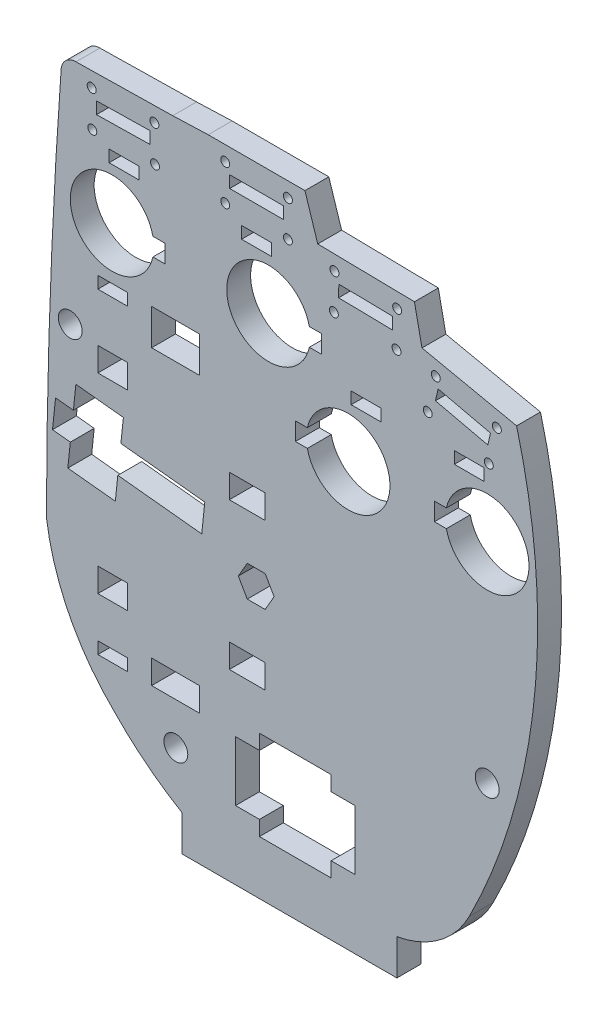
from build123d import *

# Parameters (mm, degrees)
SKETCH1_R           = 2
SKETCH1_R_2         = 0.75
SKETCH1_W           = 9
SKETCH1_H           = 2
SKETCH1_W_2         = 5
SKETCH1_W_3         = 8
SKETCH1_H_2         = 6
SKETCH1_H_3         = 4
SKETCH1_W_4         = 6
BOSS_EXTRUDE1_DEPTH = 4


with BuildPart() as part:
    # Sketch1 → Boss-Extrude1 (new body)
    with BuildSketch(Plane.XY):
        with BuildLine():
            Line((-0.718612481, -17.999985362), (-0.718612481, -23.999985362))
            Line((-0.718612481, -23.999985362), (35.281387519, -23.999985362))
            Line((35.281387519, -23.999985362), (35.281387519, -17.999985362))
            ThreePointArc((35.281387519, -17.999985362), (42.406223237, -14.93064645), (47.407370228, -8.999992681))
            ThreePointArc((47.407370228, -8.999992681), (58.276211887, 27.829327454), (55.330365794, 66.115781082))
            Line((55.330365794, 66.115781082), (39.484374663, 69.483950474))
            Line((39.484374663, 69.483950474), (38.221859922, 75.558279649))
            Line((38.221859922, 75.558279649), (22.02432726, 75.841009004))
            Line((22.02432726, 75.841009004), (19.881449124, 82.510000006))
            Line((19.881449124, 82.510000006), (3.681449124, 82.510000006))
            Line((3.681449124, 82.510000006), (-2.261308264, 82.298430785))
            Line((-2.261308264, 82.298430785), (-18.458840926, 82.015701198))
            ThreePointArc((-18.458840926, 82.015701198), (-20.226607879, 81.283468151), (-20.958840926, 79.515701198))
            ThreePointArc((-20.958840926, 79.515701198), (-22.767055021, 46.485509252), (-23.410346484, 13.412115197))
            ThreePointArc((-23.410346484, 13.412115197), (-19.613036862, 1.256548647), (-12.064479482, -8.999992681))
            ThreePointArc((-12.064479482, -8.999992681), (-6.700212214, -13.889110006), (-0.718612481, -17.999985362))
        make_face()
        with Locations((50.407370195, 11.821617405)):
            Circle(SKETCH1_R, mode=Mode.SUBTRACT)
        with Locations((-1.739971548, -9.124358763)):
            Circle(SKETCH1_R, mode=Mode.SUBTRACT)
        with Locations((6.531449125, 80.01)):
            Circle(SKETCH1_R_2, mode=Mode.SUBTRACT)
        with Locations((-19.42147321, 43.456405989)):
            Circle(SKETCH1_R, mode=Mode.SUBTRACT)
        with Locations((17.031449125, 80.01)):
            Circle(SKETCH1_R_2, mode=Mode.SUBTRACT)
        with Locations((17.031449125, 74.01)):
            Circle(SKETCH1_R_2, mode=Mode.SUBTRACT)
        with Locations((6.531449125, 74.01)):
            Circle(SKETCH1_R_2, mode=Mode.SUBTRACT)
        with Locations((-15.833929885, 79.558146704)):
            Circle(SKETCH1_R_2, mode=Mode.SUBTRACT)
        with Locations((-5.335529086, 79.741396971)):
            Circle(SKETCH1_R_2, mode=Mode.SUBTRACT)
        with Locations((-15.729215446, 73.559060533)):
            Circle(SKETCH1_R_2, mode=Mode.SUBTRACT)
        with Locations((-5.230814647, 73.7423108)):
            Circle(SKETCH1_R_2, mode=Mode.SUBTRACT)
        with Locations((35.223948537, 67.109313963)):
            Circle(SKETCH1_R_2, mode=Mode.SUBTRACT)
        with Locations((24.725547738, 67.29256423)):
            Circle(SKETCH1_R_2, mode=Mode.SUBTRACT)
        with Locations((35.328662975, 73.108400134)):
            Circle(SKETCH1_R_2, mode=Mode.SUBTRACT)
        with Locations((24.830262176, 73.291650401)):
            Circle(SKETCH1_R_2, mode=Mode.SUBTRACT)
        with Locations((40.448000847, 60.683603476)):
            Circle(SKETCH1_R_2, mode=Mode.SUBTRACT)
        with Locations((52.028592853, 64.167837794)):
            Circle(SKETCH1_R_2, mode=Mode.SUBTRACT)
        with Locations((41.797707173, 66.529823865)):
            Circle(SKETCH1_R_2, mode=Mode.SUBTRACT)
        with Locations((50.678886527, 58.321617405)):
            Circle(SKETCH1_R_2, mode=Mode.SUBTRACT)
        with Locations((11.781449159, 77.509999643)):
            Rectangle(SKETCH1_W, SKETCH1_H, mode=Mode.SUBTRACT)
        Polygon((2.597827224, 24.068199743), (3.110016694, 28.94135703), (-10.944069886, 30.418501052), (-10.525956033, 34.396588634), (-18.482131196, 35.23281634), (-18.900245049, 31.254728759), (-21.883810735, 31.568314148), (-22.396000205, 26.695156861), (-19.412434519, 26.381571471), (-19.830548372, 22.40348389), (-11.874373209, 21.567256184), (-11.456259356, 25.545343765), align=None, mode=Mode.SUBTRACT)
        with BuildLine():
            Line((22.61884629, 63.151218734), (22.61884629, 60.151218734))
            Line((22.61884629, 60.151218734), (20.61884629, 60.151218734))
            ThreePointArc((20.61884629, 60.151218734), (6.781449125, 61.651218734), (20.61884629, 63.151218734))
            Line((20.61884629, 63.151218734), (22.61884629, 63.151218734))
        make_face(mode=Mode.SUBTRACT)
        with Locations((47.407370195, 56.321617405)):
            Rectangle(SKETCH1_W_2, SKETCH1_H, mode=Mode.SUBTRACT)
        with BuildLine():
            Line((-5.581534458, 63.151218734), (-3.581534458, 63.151218734))
            Line((-3.581534458, 63.151218734), (-3.581534458, 60.151218734))
            Line((-3.581534458, 60.151218734), (-5.581534458, 60.151218734))
            ThreePointArc((-5.581534458, 60.151218734), (-19.418931624, 61.651218734), (-5.581534458, 63.151218734))
        make_face(mode=Mode.SUBTRACT)
        Polygon((-15.057865504, 78.071464466), (-6.059236247, 78.228536124), (-6.024331434, 76.228840733), (-15.022960691, 76.071769076), align=None, mode=Mode.SUBTRACT)
        with Locations((-1.794306623, 49.875576367)):
            Rectangle(SKETCH1_W_3, SKETCH1_H_2, mode=Mode.SUBTRACT)
        with Locations((30.123093592, 56.321617405)):
            Rectangle(SKETCH1_W_2, SKETCH1_H, mode=Mode.SUBTRACT)
        with Locations((11.781449125, 71.151218734)):
            Rectangle(SKETCH1_W_2, SKETCH1_H, mode=Mode.SUBTRACT)
        Polygon((25.553969338, 71.778789554), (25.519064525, 69.779094163), (34.517693781, 69.622022505), (34.552598594, 71.621717896), align=None, mode=Mode.SUBTRACT)
        with BuildLine():
            Line((20.285696426, 48.321617405), (18.285696426, 48.321617405))
            Line((18.285696426, 48.321617405), (18.285696426, 45.321617405))
            Line((18.285696426, 45.321617405), (20.285696426, 45.321617405))
            ThreePointArc((20.285696426, 45.321617405), (34.123093592, 46.821617405), (20.285696426, 48.321617405))
        make_face(mode=Mode.SUBTRACT)
        Polygon((50.960388723, 62.874995987), (42.19105814, 64.899555477), (41.741156031, 62.950815347), (50.510486614, 60.926255858), align=None, mode=Mode.SUBTRACT)
        with BuildLine():
            Line((41.569973029, 45.321617405), (43.569973029, 45.321617405))
            ThreePointArc((43.569973029, 45.321617405), (57.407370195, 46.821617405), (43.569973029, 48.321617405))
            Line((43.569973029, 48.321617405), (41.569973029, 48.321617405))
            Line((41.569973029, 48.321617405), (41.569973029, 45.321617405))
        make_face(mode=Mode.SUBTRACT)
        with Locations((-10.418931624, 71.151218734)):
            Rectangle(SKETCH1_W_2, SKETCH1_H, mode=Mode.SUBTRACT)
        Polygon((8.260028452, -2.5), (12.260028452, -2.5), (12.260028452, 0), (24.260028452, 0), (24.260028452, -2.5), (28.260028452, -2.5), (28.260028452, -12.5), (24.260028452, -12.5), (24.260028452, -15), (12.260028452, -15), (12.260028452, -12.5), (8.260028452, -12.5), align=None, mode=Mode.SUBTRACT)
        with Locations((-12.294306623, 51.875576367)):
            Rectangle(SKETCH1_W_2, SKETCH1_H, mode=Mode.SUBTRACT)
        with Locations((-1.794306623, -0.124358763)):
            Rectangle(SKETCH1_W_3, SKETCH1_H_3, mode=Mode.SUBTRACT)
        with Locations((-12.294306623, -1.124358763)):
            Rectangle(SKETCH1_W_2, SKETCH1_H, mode=Mode.SUBTRACT)
        Polygon((14.723408467, 21.026286371), (13.223408467, 23.624362582), (10.223408467, 23.624362582), (8.723408467, 21.026286371), (10.223408467, 18.428210159), (13.223408467, 18.428210159), align=None, mode=Mode.SUBTRACT)
        with Locations((10.223408467, 8.717005814)):
            Rectangle(SKETCH1_W_4, SKETCH1_H_3, mode=Mode.SUBTRACT)
        with Locations((10.223408467, 33.335566927)):
            Rectangle(SKETCH1_W_4, SKETCH1_H_3, mode=Mode.SUBTRACT)
        with Locations((-12.294306623, 8.717005814)):
            Rectangle(SKETCH1_W_2, SKETCH1_H_3, mode=Mode.SUBTRACT)
        with Locations((-12.294306623, 40.719533555)):
            Rectangle(SKETCH1_W_2, SKETCH1_H_3, mode=Mode.SUBTRACT)
    extrude(amount=BOSS_EXTRUDE1_DEPTH)


solid = part.part
